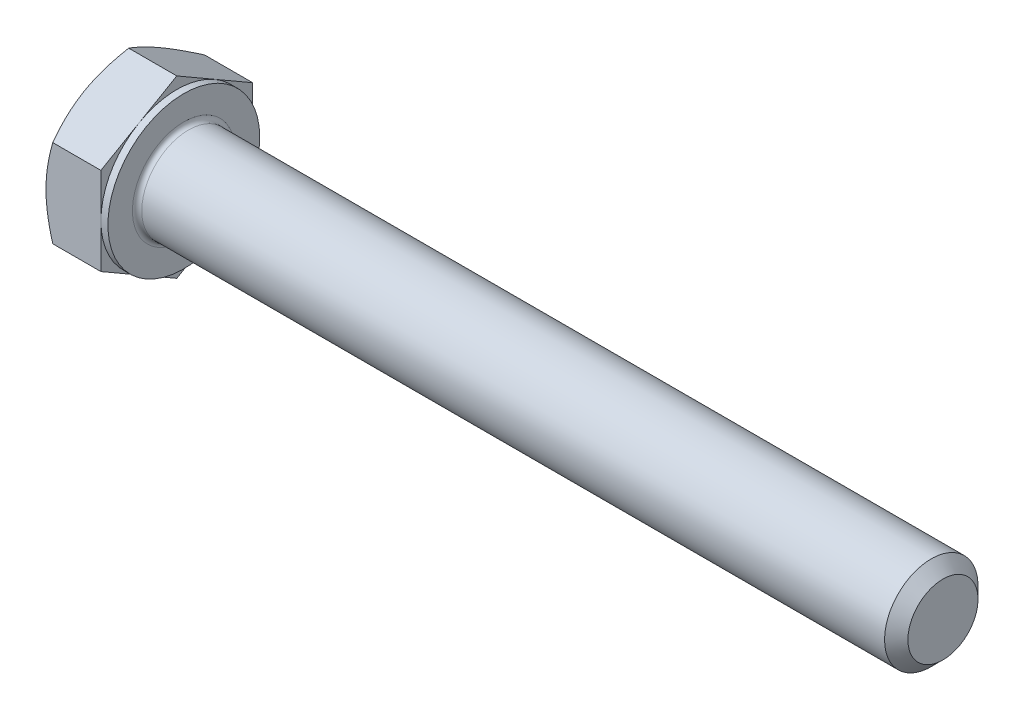
from build123d import *

# Parameters (mm, degrees)
EXTRUDE_365_DEPTH = 5.3
SKETCH_4_W        = 0.6
SKETCH_4_H        = 11.005553499
CHAMFER_2062_SIZE = 1
FILLET_2107_R     = 0.4


with BuildPart() as part:
    # 草图1 → Extrude 365 (new body)
    with BuildSketch(Plane(origin=(0, 0, 0), x_dir=(0, 0, -1), z_dir=(1, 0, 0))):
        Polygon((6.5, 3.75277675), (6.5, -3.75277675), (0, -7.505553499), (-6.5, -3.75277675), (-6.5, 3.75277675), (0, 7.505553499), align=None)
    extrude(amount=EXTRUDE_365_DEPTH)

    # 草图2 → 凸台-旋转1 (revolve)
    with BuildSketch(Plane.XY, mode=Mode.PRIVATE) as revolve_1_sk:
        Polygon((0, 0), (70.3, 0), (70.3, 2.9175), (70.3, 4), (7.791693541, 4), (0, 4), align=None)
    revolve(revolve_1_sk.sketch.rotate(Axis((0, 0, 0), (1, 0, 0)), 90), axis=Axis((0, 0, 0), (1, 0, 0)))

    # 草图3 → 切除-旋转1 (revolve, cut)
    with BuildSketch(Plane.XY):
        Polygon((0, 6.5), (3.46730793, 12.505553499), (3.46730793, 17.505553499), (-10, 17.505553499), (-10, 6.5), align=None)
    revolve(axis=Axis((0, 0, 0), (1, 0, 0)), mode=Mode.SUBTRACT)

    # 草图5 → 切除-旋转2 (revolve, cut)
    with BuildSketch(Plane.XY):
        Polygon((5.3, 6.5), (1.83269207, 12.505553499), (1.83269207, 17.505553499), (11.83269207, 17.505553499), (11.83269207, 6.5), align=None)
    revolve(axis=Axis((0, 0, 0), (1, 0, 0)), mode=Mode.SUBTRACT)

    # 草图4 → 切除-旋转3 (revolve, cut)
    with BuildSketch(Plane.XY, mode=Mode.PRIVATE) as cut_revolve_3_sk:
        with Locations((5, 12.00277675)):
            Rectangle(SKETCH_4_W, SKETCH_4_H)
    revolve(cut_revolve_3_sk.sketch.rotate(Axis((0, 0, 0), (1, 0, 0)), 270), axis=Axis((0, 0, 0), (1, 0, 0)), mode=Mode.SUBTRACT)

    # Chamfer 2062
    chamfer_2062_edges = [part.edges().sort_by_distance(p)[0] for p in [
        (70.3, 0, -4),
    ]]
    chamfer(chamfer_2062_edges, length=CHAMFER_2062_SIZE)

    # Fillet 2107
    fillet_2107_edges = [part.edges().sort_by_distance(p)[0] for p in [
        (5.3, 0, -4),
    ]]
    fillet(fillet_2107_edges, radius=FILLET_2107_R)


solid = part.part
